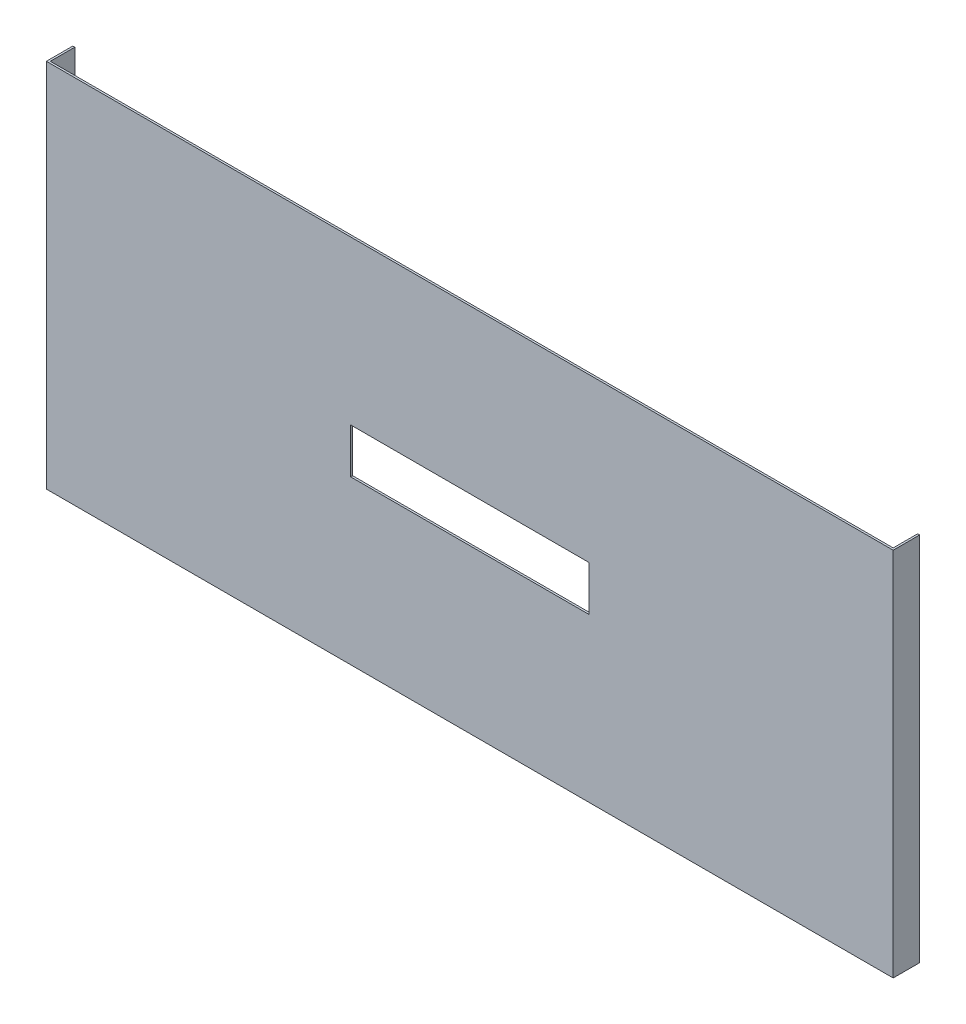
from build123d import *

# Parameters (mm, degrees)
TOPPING_KLAPE_ALT1_KAPAK_1_START = 460
TOPPING_KLAPE_ALT1_KAPAK_1_DEPTH = 280
TOPPING_KLAPE_ALT1_KAPAK_2_START = 27
SKETCH2_W                        = 180
SKETCH2_H                        = 34
TOPPING_KLAPE_ALT1_KAPAK_2_DEPTH = 14


with BuildPart() as part:
    # Sketch1 → TOPPING_klape_alt1_kapak_1 (new body)
    with BuildSketch(Plane(origin=(0, 0, 0), x_dir=(1, 0, 0), z_dir=(0, 1, 0)).offset(TOPPING_KLAPE_ALT1_KAPAK_1_START)):
        Polygon((30, -40), (30, -20), (31.5, -20), (31.5, -38.5), (668.5, -38.5), (668.5, -20), (670, -20), (670, -40), align=None)
    extrude(amount=TOPPING_KLAPE_ALT1_KAPAK_1_DEPTH)

    # Sketch2 → TOPPING_klape_alt1_kapak_2 (cut)
    with BuildSketch(Plane.XY.offset(TOPPING_KLAPE_ALT1_KAPAK_2_START)):
        with Locations((350, 600)):
            Rectangle(SKETCH2_W, SKETCH2_H)
    extrude(amount=TOPPING_KLAPE_ALT1_KAPAK_2_DEPTH, mode=Mode.SUBTRACT)


solid = part.part
